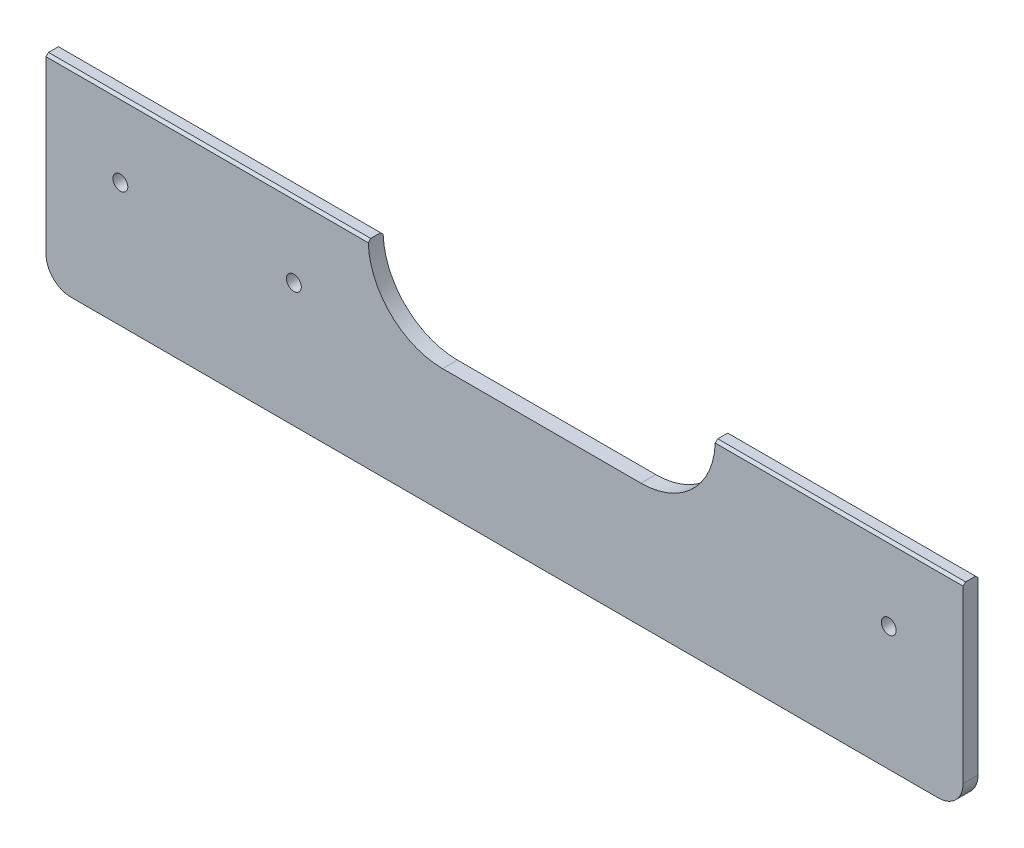
from build123d import *

# Parameters (mm, degrees)
SKETCH_1_W          = 185
SKETCH_1_H          = 40
EXTRUDE_1_DEPTH     = 3
SKETCH_2_R          = 1.5
CUT_EXTRUDE_1_DEPTH = 3
CUT_EXTRUDE_2_DEPTH = 3
FILLET_1_R          = 5
SKETCH_4_R          = 1.5
CUT_EXTRUDE_3_DEPTH = 3
CHAMFER_1_SIZE      = 0.5


with BuildPart() as part:
    # 草图1 → 凸台-拉伸1 (new body)
    with BuildSketch(Plane.XY):
        with Locations((-17.5, -5)):
            Rectangle(SKETCH_1_W, SKETCH_1_H)
    extrude(amount=EXTRUDE_1_DEPTH)

    # 草图2 → 切除-拉伸1 (cut)
    with BuildSketch(Plane.XY.offset(3)):
        with Locations((60, 0)):
            Circle(SKETCH_2_R)
        with Locations((-60, 0)):
            Circle(SKETCH_2_R)
    extrude(amount=-CUT_EXTRUDE_1_DEPTH, mode=Mode.SUBTRACT)

    # 草图3 → 切除-拉伸2 (cut)
    with BuildSketch(Plane.XY.offset(3)):
        with BuildLine():
            Line((-30, 30), (10, 30))
            ThreePointArc((10, 30), (25, 15), (10, 0))
            Line((10, 0), (-30, 0))
            ThreePointArc((-30, 0), (-45, 15), (-30, 30))
        make_face()
    extrude(amount=-CUT_EXTRUDE_2_DEPTH, mode=Mode.SUBTRACT)

    # 圆角1
    fillet_1_edges = [part.edges().sort_by_distance(p)[0] for p in [
        (75, -25, 1.5),
        (-110, -25, 1.5),
    ]]
    fillet(fillet_1_edges, radius=FILLET_1_R)

    # 草图4 → 切除-拉伸3 (cut)
    with BuildSketch(Plane.XY.offset(3)):
        with Locations((-95, 0)):
            Circle(SKETCH_4_R)
    extrude(amount=-CUT_EXTRUDE_3_DEPTH, mode=Mode.SUBTRACT)

    # 倒角1
    chamfer_1_edges = [part.edges().sort_by_distance(p)[0] for p in [
        (50, 15, 3),
        (-77.5, 15, 0),
        (-77.5, 15, 3),
        (50, 15, 0),
    ]]
    chamfer(chamfer_1_edges, length=CHAMFER_1_SIZE)


solid = part.part
